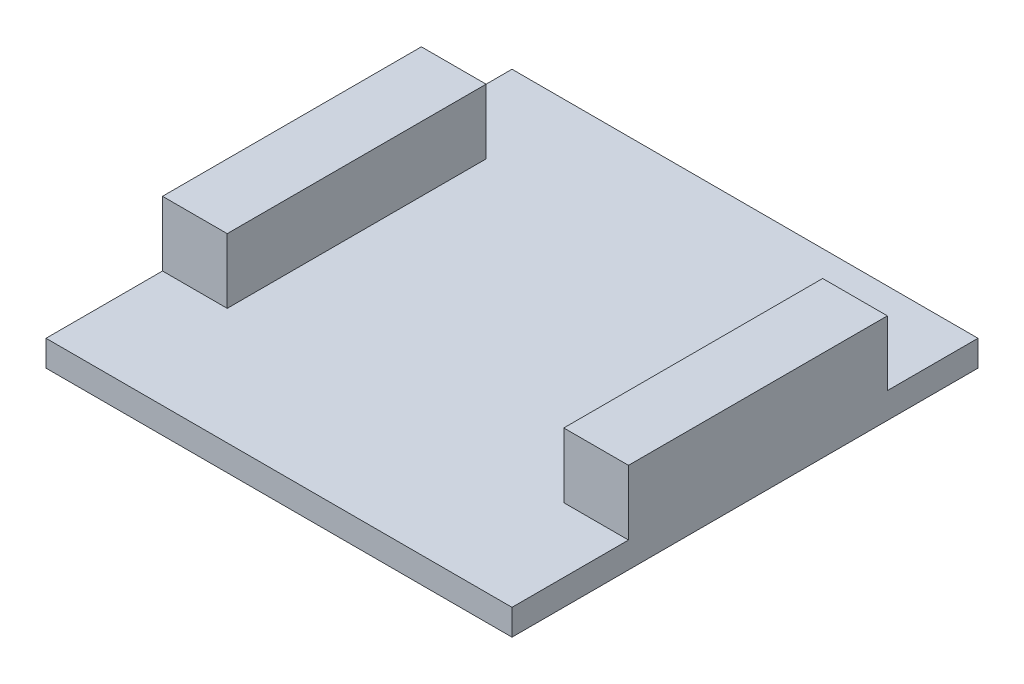
from build123d import *

# Parameters (mm, degrees)
SKETCH1_W           = 18
SKETCH1_H           = 18
BOSS_EXTRUDE1_DEPTH = 1
SKETCH2_W           = 2.5
SKETCH2_H           = 10
BOSS_EXTRUDE2_DEPTH = 2.5


with BuildPart() as part:
    # Sketch1 → Boss-Extrude1 (new body)
    with BuildSketch(Plane(origin=(0, 0, 0), x_dir=(1, 0, 0), z_dir=(0, 1, 0))):
        with Locations((9, 9)):
            Rectangle(SKETCH1_W, SKETCH1_H)
    extrude(amount=BOSS_EXTRUDE1_DEPTH)

    # Sketch2 → Boss-Extrude2 (add)
    with BuildSketch(Plane(origin=(0, 1, 0), x_dir=(1, 0, 0), z_dir=(0, 1, 0))):
        with Locations((1.25, 9.5)):
            Rectangle(SKETCH2_W, SKETCH2_H)
        with Locations((16.75, 9.5)):
            Rectangle(SKETCH2_W, SKETCH2_H)
    extrude(amount=BOSS_EXTRUDE2_DEPTH)


solid = part.part
